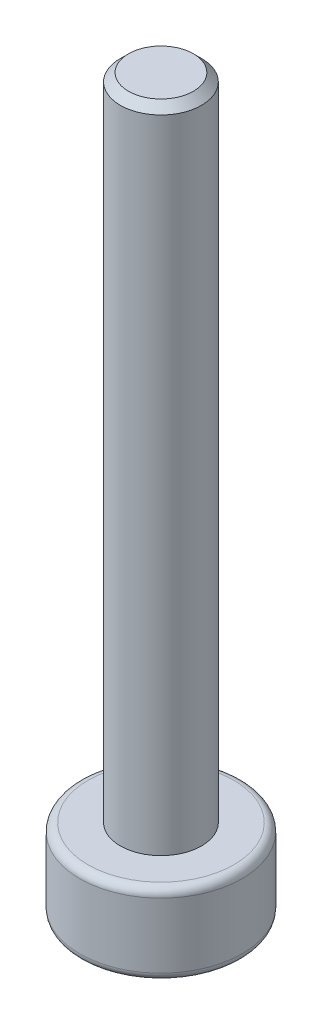
from build123d import *

# Parameters (mm, degrees)
SKETCH_2_R          = 2
EXTRUDE_1_DEPTH     = 2
SKETCH_3_R          = 1
EXTRUDE_2_DEPTH     = 16
FILLET_1_R          = 0.2
SKETCH_4_R          = 0.765
CUT_EXTRUDE_1_DEPTH = 1.52
CHAMFER_1_SIZE      = 0.1
CHAMFER_2_SIZE      = 0.2


with BuildPart() as part:
    # 草图2 → 凸台-拉伸1 (new body)
    with BuildSketch(Plane(origin=(0, 0, 0), x_dir=(1, 0, 0), z_dir=(0, 1, 0))):
        with Locations(Location((0, 0, 0), (0, 0, 270))):
            Circle(SKETCH_2_R)
    extrude(amount=EXTRUDE_1_DEPTH)

    # 草图3 → 凸台-拉伸2 (add)
    with BuildSketch(Plane(origin=(0, 2, 0), x_dir=(1, 0, 0), z_dir=(0, 1, 0))):
        with Locations(Location((0, 0, 0), (0, 0, 270))):
            Circle(SKETCH_3_R)
    extrude(amount=EXTRUDE_2_DEPTH)

    # 圆角1
    fillet_1_edges = [part.edges().sort_by_distance(p)[0] for p in [
        (0, 0, -2),
        (0, 2, -2),
    ]]
    fillet(fillet_1_edges, radius=FILLET_1_R)

    # 草图4 → 切除-拉伸1 (cut)
    with BuildSketch(Plane.XZ):
        with Locations(Location((0, 0, 0), (0, 0, 270))):
            Circle(SKETCH_4_R)
    extrude(amount=-CUT_EXTRUDE_1_DEPTH, mode=Mode.SUBTRACT)

    # 倒角1
    chamfer_1_edges = [part.edges().sort_by_distance(p)[0] for p in [
        (0, 0, 0.765),
    ]]
    chamfer(chamfer_1_edges, length=CHAMFER_1_SIZE)

    # 倒角2
    chamfer_2_edges = [part.edges().sort_by_distance(p)[0] for p in [
        (0, 18, -1),
    ]]
    chamfer(chamfer_2_edges, length=CHAMFER_2_SIZE)


solid = part.part
